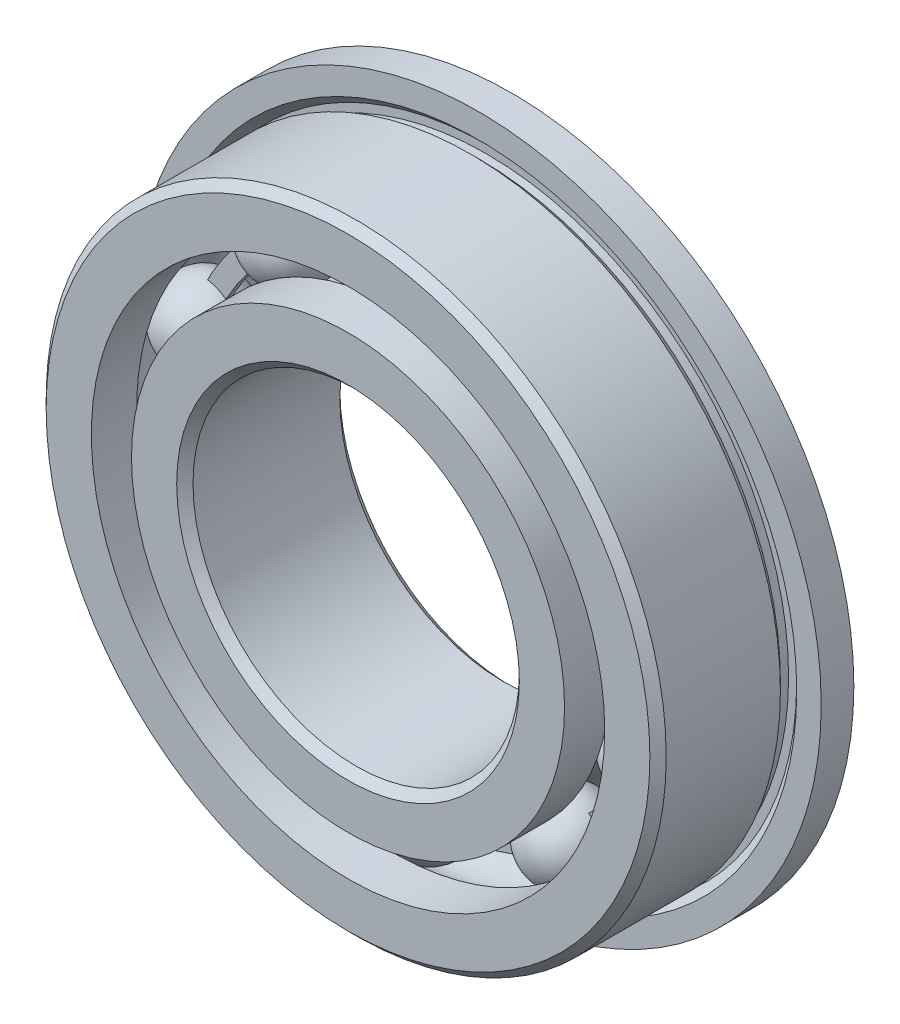
from build123d import *

# Parameters (mm, degrees)
SKETCH6_W         = 0.205128206
SKETCH6_H         = 0.615384616
CIRPATTERN1_COUNT = 10


with BuildPart() as part:
    # Sketch1 → Revolve1 (revolve)
    with BuildSketch(Plane(origin=(0, 0, 0), x_dir=(0, 0, -1), z_dir=(1, 0, 0))):
        with BuildLine():
            Line((-2.25, 9.5), (-2.5, 9.25))
            Line((-2.5, 9.25), (-2.5, 7.865384615))
            Line((-2.5, 7.865384615), (-1.111111111, 7.865384615))
            ThreePointArc((-1.111111111, 7.865384615), (0, 8.520144136), (1.111111111, 7.865384615))
            Line((1.111111111, 7.865384615), (2.5, 7.865384615))
            Line((2.5, 7.865384615), (2.5, 9.25))
            Line((2.5, 9.25), (2.5, 10.5))
            Line((2.5, 10.5), (1.5, 10.5))
            Line((1.5, 10.5), (1.5, 9.75))
            Line((1.5, 9.75), (1.75, 9.5))
            Line((1.75, 9.5), (1.75, 9.25))
            Line((1.75, 9.25), (1.5, 9.25))
            Line((1.5, 9.25), (1.25, 9.5))
            Line((1.25, 9.5), (-2.25, 9.5))
        make_face()
    revolve(axis=Axis((0, 0, 2.5), (0, 0, -1)))


with BuildPart() as body_2:
    # Sketch3 → Revolve3 (revolve)
    with BuildSketch(Plane(origin=(0, 0, 0), x_dir=(0, 0, -1), z_dir=(1, 0, 0))):
        with BuildLine():
            Line((-2.5, 6.634615385), (-1.111111111, 6.634615385))
            ThreePointArc((-1.111111111, 6.634615385), (0, 5.979855864), (1.111111111, 6.634615385))
            Line((1.111111111, 6.634615385), (2.5, 6.634615385))
            Line((2.5, 6.634615385), (2.5, 5.25))
            Line((2.5, 5.25), (2.25, 5))
            Line((2.25, 5), (-2.25, 5))
            Line((-2.25, 5), (-2.5, 5.25))
            Line((-2.5, 5.25), (-2.5, 6.634615385))
        make_face()
    revolve(axis=Axis((0, 0, 2.5), (0, 0, -1)))


with BuildPart() as body_3:
    # Sketch6 → Revolve6 (revolve)
    with BuildSketch(Plane(origin=(0, 0, 0), x_dir=(0, 0, -1), z_dir=(1, 0, 0))):
        with Locations((0, 7.25)):
            Rectangle(SKETCH6_W, SKETCH6_H)
    revolve(axis=Axis((0, 0, 2.5), (0, 0, -1)))


with BuildPart() as body_4:
    # Sketch4 → Revolve4 (revolve)
    with BuildSketch(Plane(origin=(0, 0, 0), x_dir=(0, 0, -1), z_dir=(1, 0, 0))):
        with BuildLine():
            Line((-1.270144136, 7.25), (1.270144136, 7.25))
            ThreePointArc((1.270144136, 7.25), (0, 8.520144136), (-1.270144136, 7.25))
        make_face()
    revolve(axis=Axis((0, 7.25, 1.270144136), (0, 0, -1)))


with BuildPart() as cirpattern1_1:
    # CirPattern1: pattern copy
    add(body_4.part.rotate(Axis((0, 0, -2.5), (0, 0, 1)), 1 * 360 / CIRPATTERN1_COUNT))


with BuildPart() as cirpattern1_2:
    # CirPattern1: pattern copy
    add(body_4.part.rotate(Axis((0, 0, -2.5), (0, 0, 1)), 2 * 360 / CIRPATTERN1_COUNT))


with BuildPart() as cirpattern1_3:
    # CirPattern1: pattern copy
    add(body_4.part.rotate(Axis((0, 0, -2.5), (0, 0, 1)), 3 * 360 / CIRPATTERN1_COUNT))


with BuildPart() as cirpattern1_4:
    # CirPattern1: pattern copy
    add(body_4.part.rotate(Axis((0, 0, -2.5), (0, 0, 1)), 4 * 360 / CIRPATTERN1_COUNT))


with BuildPart() as cirpattern1_5:
    # CirPattern1: pattern copy
    add(body_4.part.rotate(Axis((0, 0, -2.5), (0, 0, 1)), 5 * 360 / CIRPATTERN1_COUNT))


with BuildPart() as cirpattern1_6:
    # CirPattern1: pattern copy
    add(body_4.part.rotate(Axis((0, 0, -2.5), (0, 0, 1)), 6 * 360 / CIRPATTERN1_COUNT))


with BuildPart() as cirpattern1_7:
    # CirPattern1: pattern copy
    add(body_4.part.rotate(Axis((0, 0, -2.5), (0, 0, 1)), 7 * 360 / CIRPATTERN1_COUNT))


with BuildPart() as cirpattern1_8:
    # CirPattern1: pattern copy
    add(body_4.part.rotate(Axis((0, 0, -2.5), (0, 0, 1)), 8 * 360 / CIRPATTERN1_COUNT))


with BuildPart() as cirpattern1_9:
    # CirPattern1: pattern copy
    add(body_4.part.rotate(Axis((0, 0, -2.5), (0, 0, 1)), 9 * 360 / CIRPATTERN1_COUNT))


solid = Compound([part.part, body_2.part, body_3.part, body_4.part, cirpattern1_1.part, cirpattern1_2.part, cirpattern1_3.part, cirpattern1_4.part, cirpattern1_5.part, cirpattern1_6.part, cirpattern1_7.part, cirpattern1_8.part, cirpattern1_9.part])
